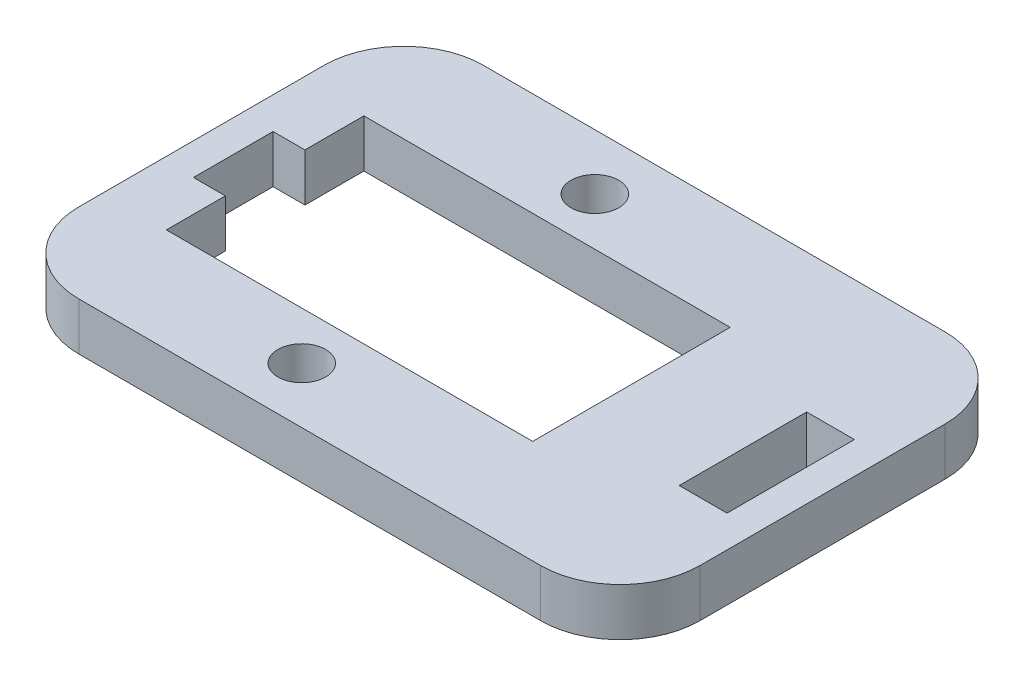
from build123d import *

# Parameters (mm, degrees)
ESBO_O1_R                = 1.5
RESSALTO_EXTRUS_O1_DEPTH = 3


with BuildPart() as part:
    # Esboço1 → Ressalto-extrusão1 (new body)
    with BuildSketch(Plane(origin=(0, 0, 0), x_dir=(1, 0, 0), z_dir=(0, 1, 0))):
        with BuildLine():
            Line((11.5, 6.5), (1, 6.5))
            ThreePointArc((1, 6.5), (-2.535533906, 5.035533906), (-4, 1.5))
            Line((-4, 1.5), (-4, -13.9))
            ThreePointArc((-4, -13.9), (-2.535533906, -17.435533906), (1, -18.9))
            Line((1, -18.9), (30, -18.9))
            ThreePointArc((30, -18.9), (33.535533906, -17.435533906), (35, -13.9))
            Line((35, -13.9), (35, 1.5))
            ThreePointArc((35, 1.5), (33.535533906, 5.035533906), (30, 6.5))
            Line((30, 6.5), (11.5, 6.5))
        make_face()
        with Locations(Location((11.5, 3, 0), (0, 0, 270))):
            Circle(ESBO_O1_R, mode=Mode.SUBTRACT)
        with Locations(Location((11.5, -15.4, 0), (0, 0, 90))):
            Circle(ESBO_O1_R, mode=Mode.SUBTRACT)
        Polygon((0, 0), (23, 0), (23, -12.4), (0, -12.4), (0, -8.7), (-2, -8.7), (-2, -3.7), (0, -3.7), align=None, mode=Mode.SUBTRACT)
        Polygon((30, -6.2), (30, -2.2), (33, -2.2), (33, -10.2), (30, -10.2), align=None, mode=Mode.SUBTRACT)
    extrude(amount=RESSALTO_EXTRUS_O1_DEPTH)


solid = part.part
